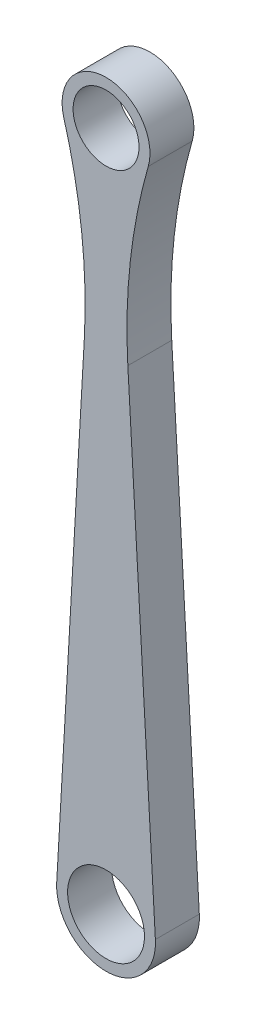
from build123d import *

# Parameters (mm, degrees)
SKETCH_1_R      = 3
SKETCH_1_R_2    = 3.5
EXTRUDE_1_DEPTH = 2


with BuildPart() as part:
    # 草图1 → 凸台-拉伸1 (new, symmetric)
    with BuildSketch(Plane.XY):
        with BuildLine():
            ThreePointArc((-3.844739387, -1.103620878), (-2.213352607, -9.345380488), (-1.984991162, -17.743944374))
            Line((-1.984991162, -17.743944374), (-4.492709151, -61.743944374))
            ThreePointArc((-4.492709151, -61.743944374), (0, -66.5), (4.492709151, -61.743944374))
            Line((4.492709151, -61.743944374), (1.984991162, -17.743944374))
            ThreePointArc((1.984991162, -17.743944374), (2.213352607, -9.345380488), (3.844739387, -1.103620878))
            ThreePointArc((3.844739387, -1.103620878), (0, 4), (-3.844739387, -1.103620878))
        make_face()
        Circle(SKETCH_1_R, mode=Mode.SUBTRACT)
        with Locations((0, -62)):
            Circle(SKETCH_1_R_2, mode=Mode.SUBTRACT)
    extrude(amount=EXTRUDE_1_DEPTH, both=True)


solid = part.part
